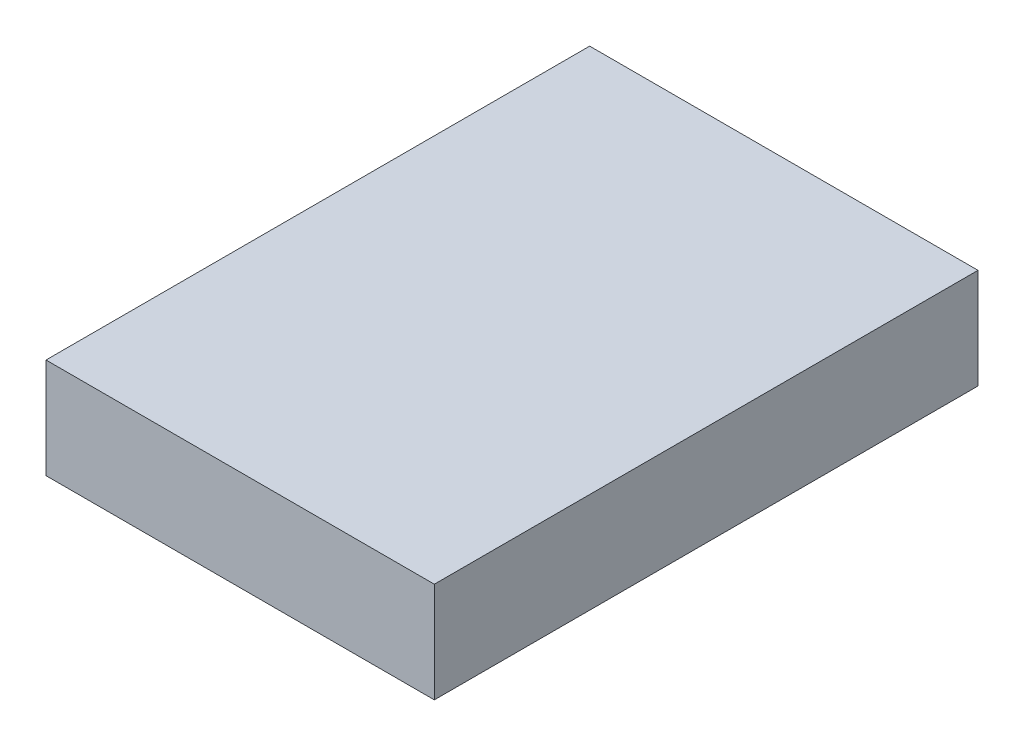
from build123d import *

# Parameters (mm, degrees)
SKETCH3_W           = 63.5
SKETCH3_H           = 88.9
BOSS_EXTRUDE1_DEPTH = 16.383


with BuildPart() as part:
    # Sketch3 → Boss-Extrude1 (new body)
    with BuildSketch(Plane(origin=(0, 0, 0), x_dir=(1, 0, 0), z_dir=(0, 1, 0))):
        with Locations((31.75, 44.45)):
            Rectangle(SKETCH3_W, SKETCH3_H)
    extrude(amount=BOSS_EXTRUDE1_DEPTH)


solid = part.part
